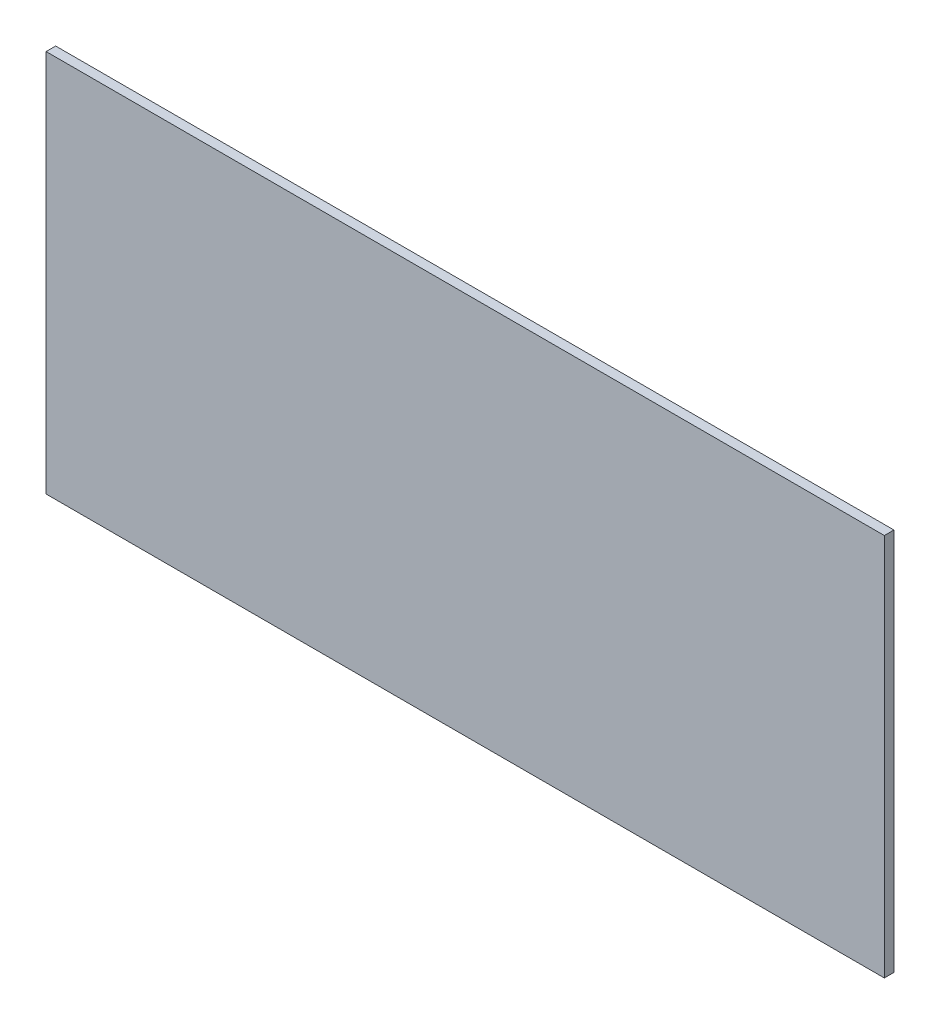
from build123d import *

# Parameters (mm, degrees)
SKETCH_1_W      = 350
SKETCH_1_H      = 160
EXTRUDE_1_DEPTH = 4


with BuildPart() as part:
    # 草图1 → 凸台-拉伸1 (new body)
    with BuildSketch(Plane.XY):
        Rectangle(SKETCH_1_W, SKETCH_1_H)
    extrude(amount=EXTRUDE_1_DEPTH)


solid = part.part
